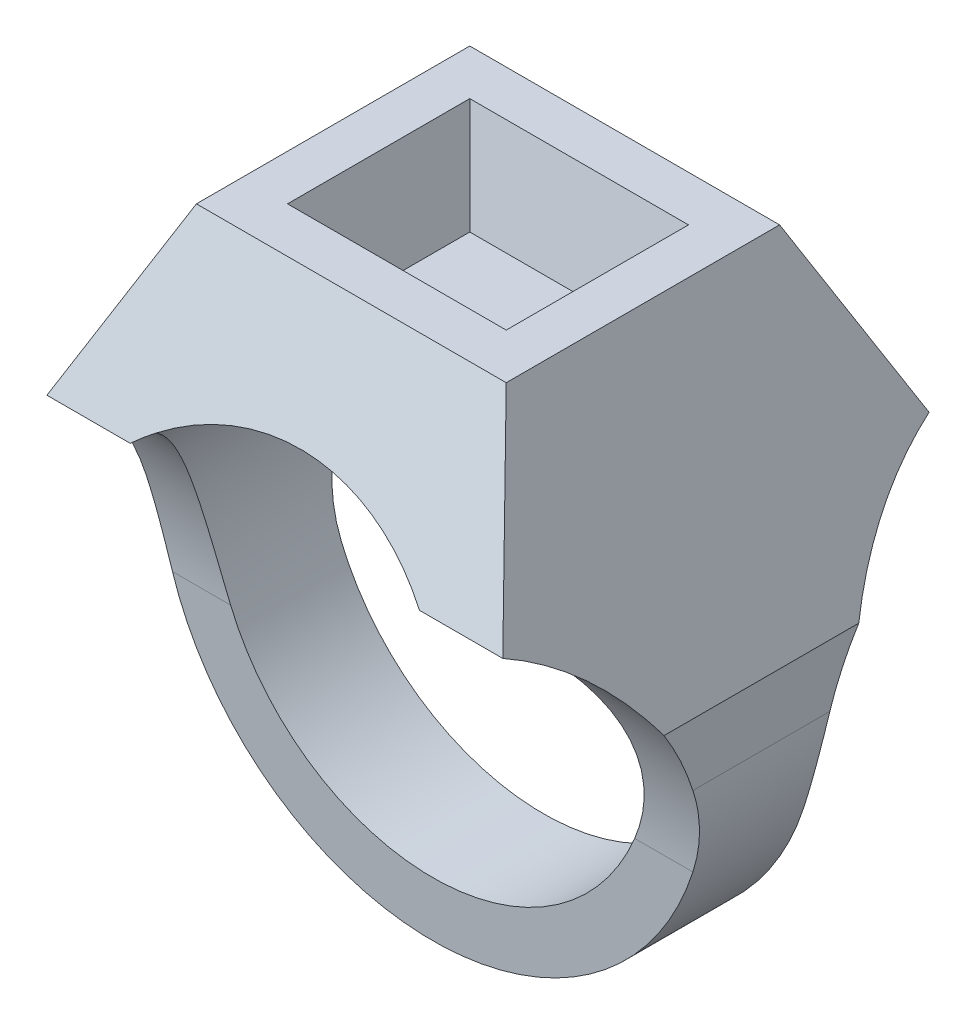
from build123d import *

# Parameters (mm, degrees)
SKETCH_1_R                    = 12
EXTRUDE_1_DEPTH               = 25
CUT_EXTRUDE_1_DEPTH           = 35.263683398
CUT_EXTRUDE_1_DEPTH_BACK      = 35.263683398
SKETCH_2_OUTSIDE_W            = 65.4
SKETCH_2_OUTSIDE_H            = 48.4
SKETCH_3_W                    = 12
SKETCH_3_H                    = 10
CUT_EXTRUDE_2_DEPTH           = 5
CUT_EXTRUDE_2_TAPER           = 15
CUT_EXTRUDE_2_OTHER_WAY_DEPTH = 39.089557823


with BuildPart() as part:
    # 草图1 → 凸台-拉伸1 (new, symmetric)
    with BuildSketch(Plane.XY):
        with BuildLine():
            Line((-8.5, 18), (8.5, 18))
            Line((8.5, 18), (15, 3.40076097))
            Line((15, 3.40076097), (15, 0))
            ThreePointArc((15, 0), (0, -15), (-15, 0))
            Line((-15, 0), (-15, 3.40076097))
            Line((-15, 3.40076097), (-8.5, 18))
        make_face()
        Circle(SKETCH_1_R, mode=Mode.SUBTRACT)
    extrude(amount=EXTRUDE_1_DEPTH, both=True)

    # 草图2 outside → 切除-拉伸1 (cut, two sides: drawn at the far end of the back side and taken through both)
    with BuildSketch(Plane(origin=(0, 0, 0), x_dir=(0, 0, -1), z_dir=(1, 0, 0)).offset(-CUT_EXTRUDE_1_DEPTH_BACK)):
        with Locations((0, 1.5)):
            Rectangle(SKETCH_2_OUTSIDE_W, SKETCH_2_OUTSIDE_H)
        with BuildLine():
            Line((-7.5, 18), (7.5, 18))
            Line((7.5, 18), (11.696768923, 9))
            ThreePointArc((11.696768923, 9), (5.385171162, 3.46487732), (3.03604285, -4.594616806))
            Line((3.03604285, -4.594616806), (3.03604285, -15))
            Line((3.03604285, -15), (-3.03604285, -15))
            Line((-3.03604285, -15), (-3.03604285, -4.594616806))
            ThreePointArc((-3.03604285, -4.594616806), (-5.385171162, 3.46487732), (-11.696768923, 9))
            Line((-11.696768923, 9), (-7.5, 18))
        make_face(mode=Mode.SUBTRACT)
    extrude(amount=CUT_EXTRUDE_1_DEPTH + CUT_EXTRUDE_1_DEPTH_BACK, mode=Mode.SUBTRACT)

    # 草图3 → 切除-拉伸2 (cut)
    with BuildSketch(Plane(origin=(0, 18, 0), x_dir=(1, 0, 0), z_dir=(0, 1, 0))):
        Rectangle(SKETCH_3_W, SKETCH_3_H)
    extrude(amount=-CUT_EXTRUDE_2_DEPTH, taper=CUT_EXTRUDE_2_TAPER, mode=Mode.SUBTRACT)

    # 草图3 → 切除-拉伸2 other way (cut)
    with BuildSketch(Plane(origin=(0, 18, 0), x_dir=(1, 0, 0), z_dir=(0, 1, 0))):
        Rectangle(SKETCH_3_W, SKETCH_3_H)
    extrude(amount=CUT_EXTRUDE_2_OTHER_WAY_DEPTH, mode=Mode.SUBTRACT)


solid = part.part
